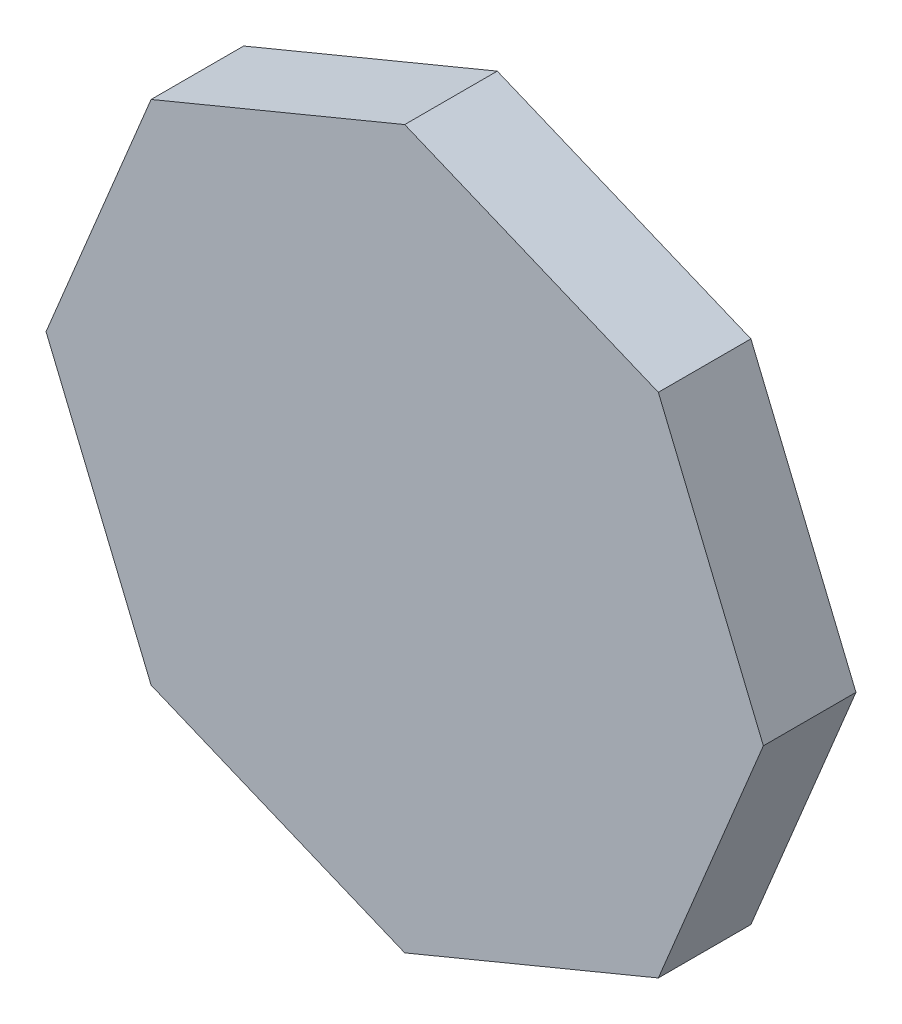
from build123d import *

# Parameters (mm, degrees)
BOSS_EXTRUDE1_DEPTH = 8


with BuildPart() as part:
    # Sketch1 → Boss-Extrude1 (new body)
    with BuildSketch(Plane.XY):
        Polygon((30.346666667, 0), (21.266976883, 21.920310217), (-0.653333333, 31), (-22.57364355, 21.920310217), (-31.653333333, 0), (-22.57364355, -21.920310217), (-0.653333333, -31), (21.266976883, -21.920310217), align=None)
    extrude(amount=BOSS_EXTRUDE1_DEPTH)


solid = part.part
